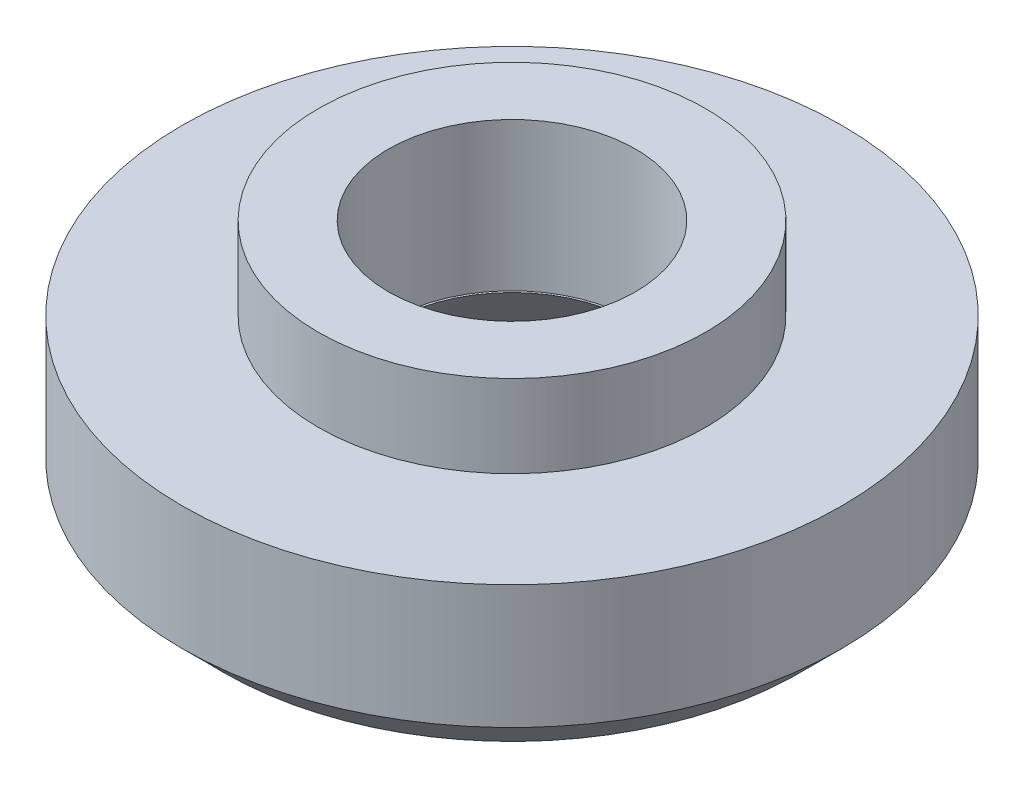
from build123d import *

# Parameters (mm, degrees)
SKETCH2_R           = 2.35
BOSS_EXTRUDE1_DEPTH = 1
SKETCH3_R           = 4
BOSS_EXTRUDE2_DEPTH = 2
SKETCH4_R           = 2.675
CUT_EXTRUDE1_DEPTH  = 1.8
CUT_EXTRUDE1_DRAFT  = -45
SKETCH5_R           = 1.5
CUT_EXTRUDE2_DEPTH  = 1.8
CHAMFER1_SIZE       = 0.5


with BuildPart() as part:
    # Sketch2 → Boss-Extrude1 (new body)
    with BuildSketch(Plane(origin=(0, 0, 0), x_dir=(1, 0, 0), z_dir=(0, 1, 0))):
        with Locations(Location((0, 0, 0), (0, 0, 270))):
            Circle(SKETCH2_R)
    extrude(amount=BOSS_EXTRUDE1_DEPTH)

    # Sketch3 → Boss-Extrude2 (add)
    with BuildSketch(Plane.XZ):
        with Locations(Location((0, 0, 0), (0, 0, 270))):
            Circle(SKETCH3_R)
    extrude(amount=BOSS_EXTRUDE2_DEPTH)


with BuildPart() as cut_extrude1_tool:
    # Sketch4 → Cut-Extrude1 (with draft: the straight prism first)
    with BuildSketch(Plane.XZ.offset(2)):
        Circle(SKETCH4_R)
    extrude(amount=-CUT_EXTRUDE1_DEPTH)
    # Cut-Extrude1: the draft: its side faces are tilted about the plane it starts from
    cut_extrude1_sides = [cut_extrude1_tool.faces().sort_by_distance(p)[0] for p in [
        (-2.675, -1.1, 0),
    ]]
    draft(cut_extrude1_sides, Plane.XZ.offset(2), CUT_EXTRUDE1_DRAFT)


with BuildPart() as part_1:
    add(part.part)

    # Cut-Extrude1: cut by cut_extrude1_tool
    add(cut_extrude1_tool.part, mode=Mode.SUBTRACT)

    # Sketch5 → Cut-Extrude2 (cut)
    with BuildSketch(Plane(origin=(0, 1, 0), x_dir=(1, 0, 0), z_dir=(0, 1, 0))):
        with Locations(Location((0, 0, 0), (0, 0, 270))):
            Circle(SKETCH5_R)
    extrude(amount=-CUT_EXTRUDE2_DEPTH, mode=Mode.SUBTRACT)

    # Chamfer1
    chamfer1_edges = [part_1.edges().sort_by_distance(p)[0] for p in [
        (0, -2, 4),
    ]]
    chamfer(chamfer1_edges, length=CHAMFER1_SIZE)


solid = part_1.part
